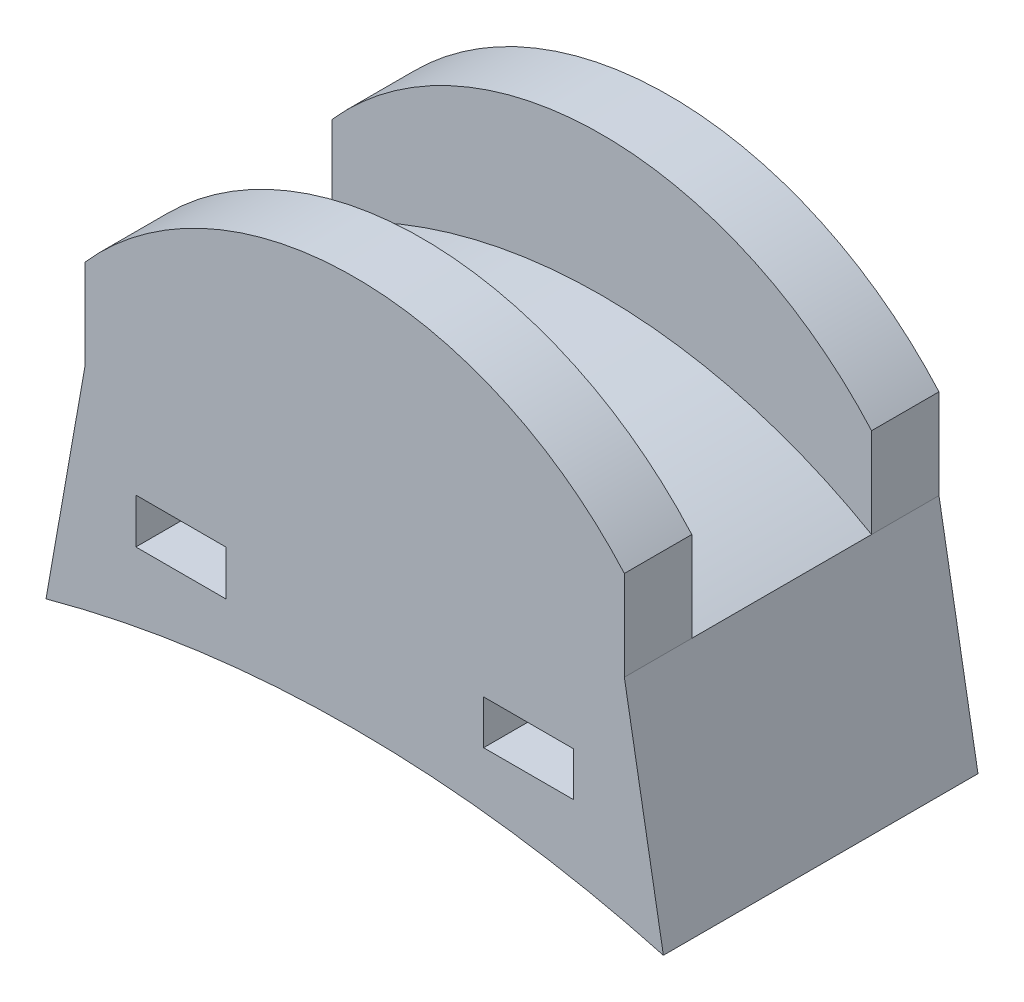
from build123d import *

# Parameters (mm, degrees)
BOSS_EXTRUDE1_DEPTH = 25.4
BOSS_EXTRUDE2_DEPTH = 9.525
BOSS_EXTRUDE3_START = 9.525
BOSS_EXTRUDE3_DEPTH = 9.525
CUT_EXTRUDE2_DEPTH  = 99.135296592
SKETCH6_W           = 12.7
SKETCH6_H           = 6.223
SKETCH6_H_2         = 6.35
CUT_EXTRUDE3_DEPTH  = 99.135296592


with BuildPart() as part:
    # Sketch1 → Boss-Extrude1 (new body)
    with BuildSketch(Plane.XY):
        with BuildLine():
            Line((-76.2, 0), (-81.713329641, -31.267646158))
            Line((-81.713329641, -31.267646158), (5.513329641, -31.267646158))
            Line((5.513329641, -31.267646158), (0, 0))
            ThreePointArc((0, 0), (-38.1, 10.208864232), (-76.2, 0))
        make_face()
    extrude(amount=BOSS_EXTRUDE1_DEPTH)

    # Sketch2 → Boss-Extrude2 (add)
    with BuildSketch(Plane.XY.offset(25.4)):
        with BuildLine():
            Line((-76.2, 12.7), (-76.2, 0))
            Line((-76.2, 0), (-81.713329641, -31.267646158))
            Line((-81.713329641, -31.267646158), (5.513329641, -31.267646158))
            Line((5.513329641, -31.267646158), (0, 0))
            Line((0, 0), (0, 12.7))
            ThreePointArc((0, 12.7), (-38.1, 29.898958349), (-76.2, 12.7))
        make_face()
    extrude(amount=BOSS_EXTRUDE2_DEPTH)

    # Sketch3 → Boss-Extrude3 (add)
    with BuildSketch(Plane(origin=(0, 0, 0), x_dir=(-1, 0, 0), z_dir=(0, 0, -1)).offset(BOSS_EXTRUDE3_START)):
        with BuildLine():
            Line((0, 0), (0, 12.7))
            ThreePointArc((0, 12.7), (38.1, 29.898958349), (76.2, 12.7))
            Line((76.2, 12.7), (76.2, 0))
            Line((76.2, 0), (81.713329641, -31.267646158))
            Line((81.713329641, -31.267646158), (-5.513329641, -31.267646158))
            Line((-5.513329641, -31.267646158), (0, 0))
        make_face()
    extrude(amount=-BOSS_EXTRUDE3_DEPTH)

    # Sketch5 → Cut-Extrude2 (cut, through all)
    with BuildSketch(Plane(origin=(0, 0, -9.525), x_dir=(-1, 0, 0), z_dir=(0, 0, -1))):
        with BuildLine():
            Line((-5.513329641, -31.267646158), (81.713329641, -31.267646158))
            ThreePointArc((81.713329641, -31.267646158), (38.1, -25.402967232), (-5.513329641, -31.267646158))
        make_face()
    extrude(amount=-CUT_EXTRUDE2_DEPTH, mode=Mode.SUBTRACT)

    # Sketch6 → Cut-Extrude3 (cut, through all)
    with BuildSketch(Plane(origin=(0, 0, -9.525), x_dir=(-1, 0, 0), z_dir=(0, 0, -1))):
        with Locations((13.536670359, -15.456146158)):
            Rectangle(SKETCH6_W, SKETCH6_H)
        with Locations((62.663329641, -15.392646158)):
            Rectangle(SKETCH6_W, SKETCH6_H_2)
    extrude(amount=-CUT_EXTRUDE3_DEPTH, mode=Mode.SUBTRACT)


solid = part.part
